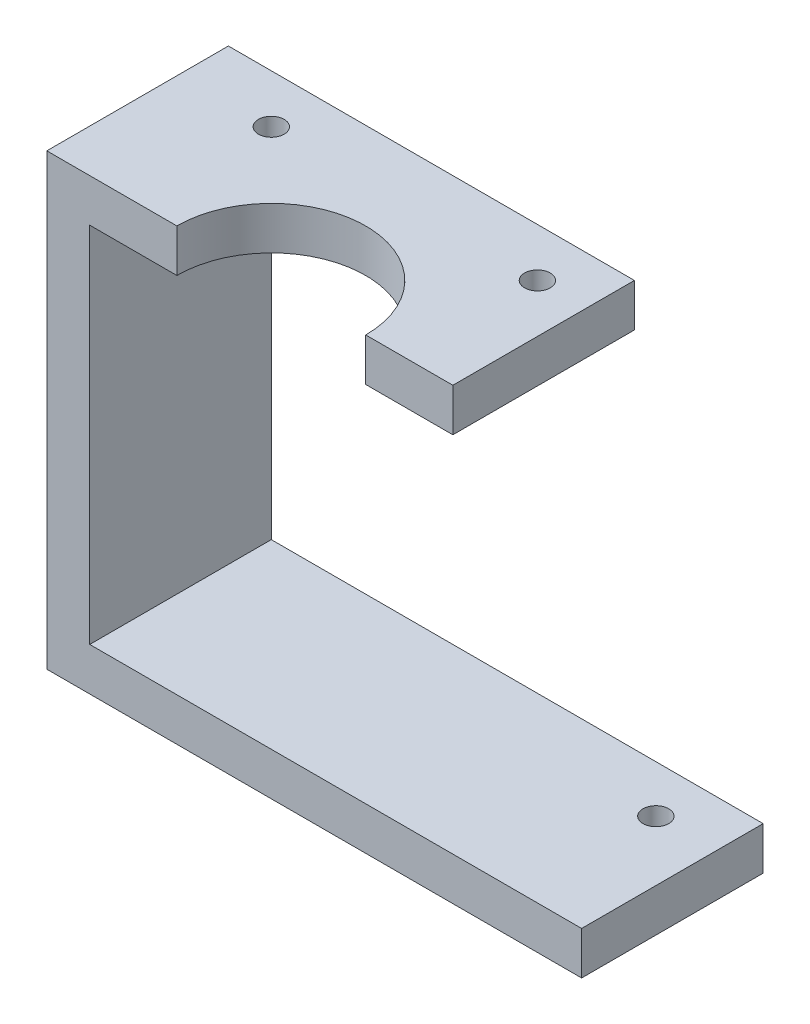
from build123d import *

# Parameters (mm, degrees)
SKETCH1_W           = 62.3
SKETCH1_H           = 42.3
BOSS_EXTRUDE1_DEPTH = 5
SKETCH2_W           = 5
SKETCH2_H           = 42.3
BOSS_EXTRUDE2_DEPTH = 42.3
SKETCH3_W           = 47.3
SKETCH3_H           = 42.3
SKETCH3_R           = 11
BOSS_EXTRUDE3_DEPTH = 5
SKETCH4_R           = 1.5
CUT_EXTRUDE1_DEPTH  = 5
SKETCH5_R           = 1.5
CUT_EXTRUDE2_DEPTH  = 5
SKETCH6_W           = 66.403823896
SKETCH6_H           = 55.517872021
CUT_EXTRUDE3_DEPTH  = 40


with BuildPart() as part:
    # Sketch1 → Boss-Extrude1 (new body)
    with BuildSketch(Plane(origin=(0, 0, 0), x_dir=(1, 0, 0), z_dir=(0, 1, 0))):
        with Locations((31.15, 21.15)):
            Rectangle(SKETCH1_W, SKETCH1_H)
    extrude(amount=BOSS_EXTRUDE1_DEPTH)

    # Sketch2 → Boss-Extrude2 (add)
    with BuildSketch(Plane(origin=(0, 5, 0), x_dir=(1, 0, 0), z_dir=(0, 1, 0))):
        with Locations((2.5, 21.15)):
            Rectangle(SKETCH2_W, SKETCH2_H)
    extrude(amount=BOSS_EXTRUDE2_DEPTH)

    # Sketch3 → Boss-Extrude3 (add)
    with BuildSketch(Plane(origin=(0, 47.3, 0), x_dir=(1, 0, 0), z_dir=(0, 1, 0))):
        with Locations((23.65, 21.15)):
            Rectangle(SKETCH3_W, SKETCH3_H)
        with Locations(Location((26.15, 21.15, 0), (0, 0, 270))):
            Circle(SKETCH3_R, mode=Mode.SUBTRACT)
    extrude(amount=BOSS_EXTRUDE3_DEPTH)

    # Sketch4 → Cut-Extrude1 (cut)
    with BuildSketch(Plane(origin=(0, 52.3, 0), x_dir=(1, 0, 0), z_dir=(0, 1, 0))):
        with Locations(Location((41.65, 36.65, 0), (0, 0, 270))):
            Circle(SKETCH4_R)
        with Locations(Location((10.65, 36.65, 0), (0, 0, 270))):
            Circle(SKETCH4_R)
        with Locations(Location((10.65, 5.65, 0), (0, 0, 270))):
            Circle(SKETCH4_R)
        with Locations(Location((41.65, 5.65, 0), (0, 0, 270))):
            Circle(SKETCH4_R)
    extrude(amount=-CUT_EXTRUDE1_DEPTH, mode=Mode.SUBTRACT)

    # Sketch5 → Cut-Extrude2 (cut)
    with BuildSketch(Plane(origin=(0, 5, 0), x_dir=(1, 0, 0), z_dir=(0, 1, 0))):
        with Locations(Location((55.3, 5.5, 0), (0, 0, 270))):
            Circle(SKETCH5_R)
        with Locations(Location((55.3, 36.8, 0), (0, 0, 270))):
            Circle(SKETCH5_R)
    extrude(amount=-CUT_EXTRUDE2_DEPTH, mode=Mode.SUBTRACT)

    # Sketch6 → Cut-Extrude3 (cut)
    with BuildSketch(Plane(origin=(0, 0, -21.15), x_dir=(-1, 0, 0), z_dir=(0, 0, -1))):
        with Locations((-30.988329777, 26.343035963)):
            Rectangle(SKETCH6_W, SKETCH6_H)
    extrude(amount=-CUT_EXTRUDE3_DEPTH, mode=Mode.SUBTRACT)


solid = part.part
